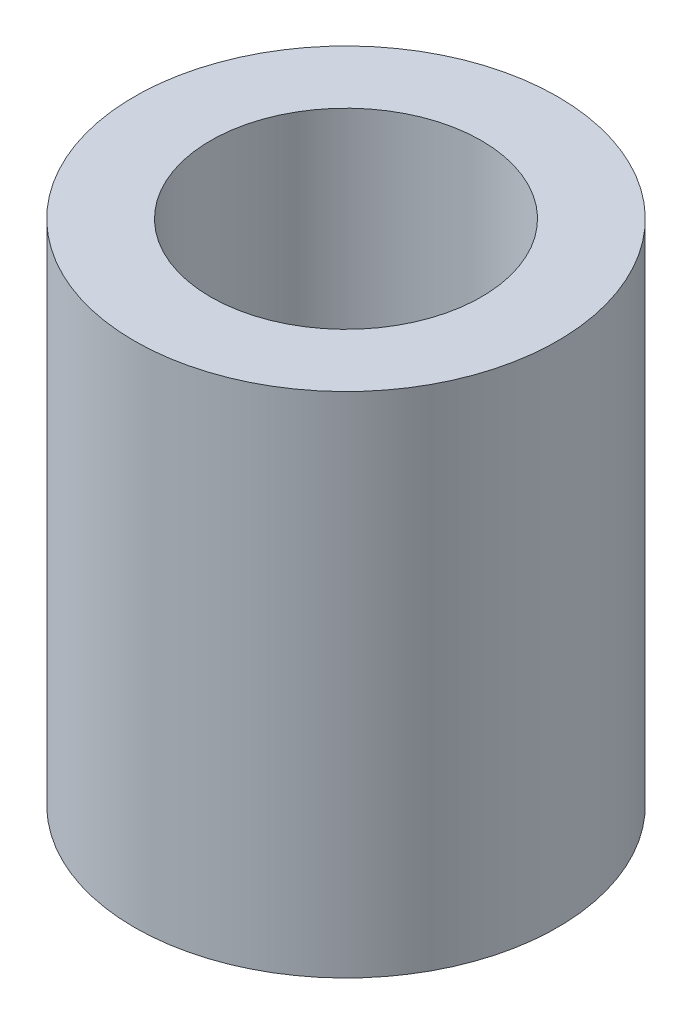
from build123d import *

# Parameters (mm, degrees)
SKETCH1_R            = 2.5
BOSS_EXTRUDE1_DEPTH  = 3
M3_CLEARANCE_HOLE1_D = 3.2


with BuildPart() as part:
    # Sketch1 → Boss-Extrude1 (new, symmetric)
    with BuildSketch(Plane(origin=(0, 0, 0), x_dir=(1, 0, 0), z_dir=(0, 1, 0))):
        with Locations(Location((0, 0, 0), (0, 0, 270))):
            Circle(SKETCH1_R)
    extrude(amount=BOSS_EXTRUDE1_DEPTH, both=True)

    # M3 Clearance Hole1 (through all)
    with Locations(Plane(origin=(0, 3, 0), x_dir=(1, 0, 0), z_dir=(0, 1, 0))):
        with Locations((0, 0)):
            Hole(M3_CLEARANCE_HOLE1_D / 2)


solid = part.part
